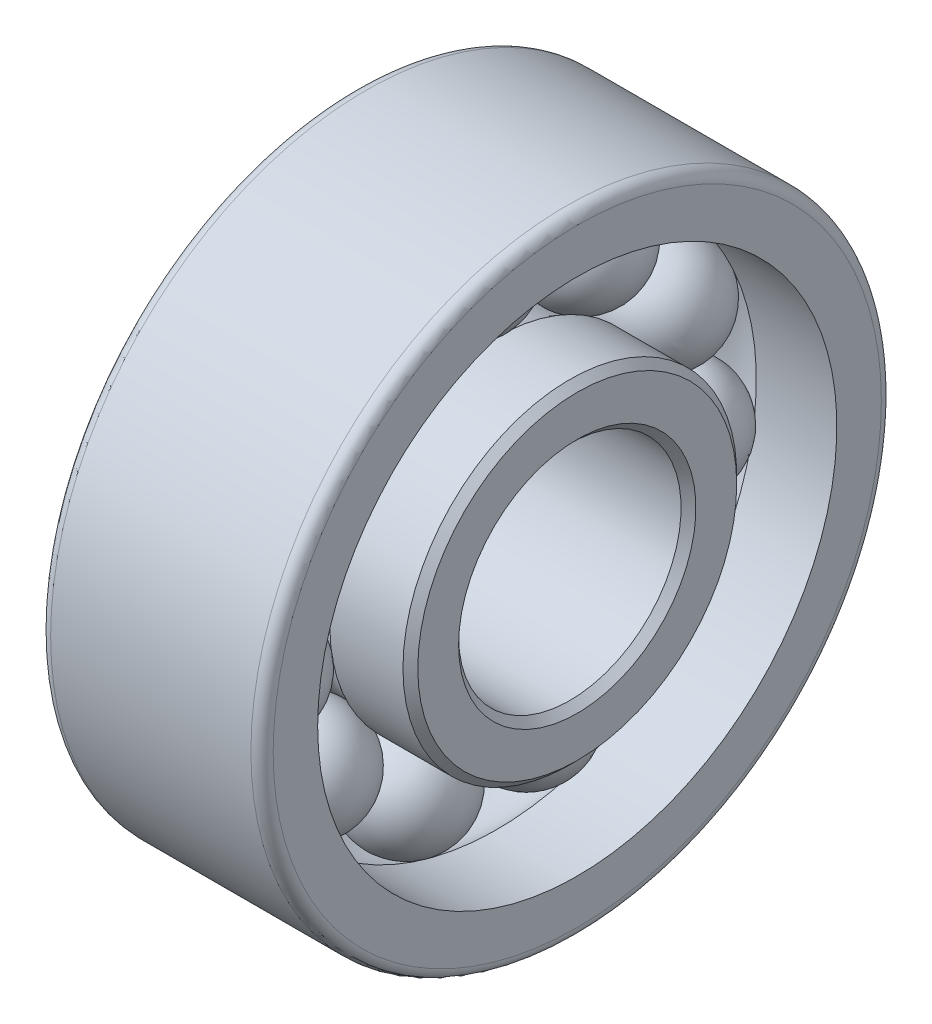
from build123d import *

# Parameters (mm, degrees)
PATTERN_CIRCULAR_5_COUNT = 11
FILLET_1_R               = 0.3
CHAMFER_1_SIZE           = 0.2


with BuildPart() as part:
    # Эскиз1 → Повернуть1 (revolve)
    with BuildSketch(Plane.XY, mode=Mode.PRIVATE) as revolve_1_sk:
        with BuildLine():
            Line((0, 0), (6, 0))
            Line((6, 0), (6, 1.5))
            Line((6, 1.5), (3.829156198, 1.5))
            ThreePointArc((3.829156198, 1.5), (3, 1.25), (2.170843802, 1.5))
            Line((2.170843802, 1.5), (0, 1.5))
            Line((0, 1.5), (0, 0))
        make_face()
        with BuildLine():
            Line((0, 4), (2.170843802, 4))
            ThreePointArc((2.170843802, 4), (3, 4.25), (3.829156198, 4))
            Line((3.829156198, 4), (6, 4))
            Line((6, 4), (6, 5.5))
            Line((6, 5.5), (0, 5.5))
            Line((0, 5.5), (0, 4))
        make_face()
    revolve(revolve_1_sk.sketch.rotate(Axis((-1.066901408, -3, 0), (1, 0, 0)), 90), axis=Axis((-1.066901408, -3, 0), (1, 0, 0)))

    # Скругление1
    fillet_1_edges = [part.edges().sort_by_distance(p)[0] for p in [
        (0, -3, -8.5),
        (6, -3, -8.5),
    ]]
    fillet(fillet_1_edges, radius=FILLET_1_R)

    # Фаска1
    chamfer_1_edges = [part.edges().sort_by_distance(p)[0] for p in [
        (0, -3, -4.5),
        (6, -3, -4.5),
        (6, -3, -3),
        (0, -3, -3),
    ]]
    chamfer(chamfer_1_edges, length=CHAMFER_1_SIZE)


with BuildPart() as body_2:
    # Эскиз2 → Повернуть2 (revolve)
    with BuildSketch(Plane.XY):
        with BuildLine():
            Line((3, 4.25), (3, 1.25))
            ThreePointArc((3, 1.25), (1.5, 2.75), (3, 4.25))
        make_face()
    revolve(axis=Axis((3, 4.25, 0), (0, -1, 0)))


with BuildPart() as pattern_circular_5_1:
    # Круговой массив5: pattern copy
    add(body_2.part.rotate(Axis((0, -3, 0), (1, 0, 0)), 1 * 360 / PATTERN_CIRCULAR_5_COUNT))


with BuildPart() as pattern_circular_5_2:
    # Круговой массив5: pattern copy
    add(body_2.part.rotate(Axis((0, -3, 0), (1, 0, 0)), 2 * 360 / PATTERN_CIRCULAR_5_COUNT))


with BuildPart() as pattern_circular_5_3:
    # Круговой массив5: pattern copy
    add(body_2.part.rotate(Axis((0, -3, 0), (1, 0, 0)), 3 * 360 / PATTERN_CIRCULAR_5_COUNT))


with BuildPart() as pattern_circular_5_4:
    # Круговой массив5: pattern copy
    add(body_2.part.rotate(Axis((0, -3, 0), (1, 0, 0)), 4 * 360 / PATTERN_CIRCULAR_5_COUNT))


with BuildPart() as pattern_circular_5_5:
    # Круговой массив5: pattern copy
    add(body_2.part.rotate(Axis((0, -3, 0), (1, 0, 0)), 5 * 360 / PATTERN_CIRCULAR_5_COUNT))


with BuildPart() as pattern_circular_5_6:
    # Круговой массив5: pattern copy
    add(body_2.part.rotate(Axis((0, -3, 0), (1, 0, 0)), 6 * 360 / PATTERN_CIRCULAR_5_COUNT))


with BuildPart() as pattern_circular_5_7:
    # Круговой массив5: pattern copy
    add(body_2.part.rotate(Axis((0, -3, 0), (1, 0, 0)), 7 * 360 / PATTERN_CIRCULAR_5_COUNT))


with BuildPart() as pattern_circular_5_8:
    # Круговой массив5: pattern copy
    add(body_2.part.rotate(Axis((0, -3, 0), (1, 0, 0)), 8 * 360 / PATTERN_CIRCULAR_5_COUNT))


with BuildPart() as pattern_circular_5_9:
    # Круговой массив5: pattern copy
    add(body_2.part.rotate(Axis((0, -3, 0), (1, 0, 0)), 9 * 360 / PATTERN_CIRCULAR_5_COUNT))


with BuildPart() as pattern_circular_5_10:
    # Круговой массив5: pattern copy
    add(body_2.part.rotate(Axis((0, -3, 0), (1, 0, 0)), 10 * 360 / PATTERN_CIRCULAR_5_COUNT))


solid = Compound([part.part, body_2.part, pattern_circular_5_1.part, pattern_circular_5_2.part, pattern_circular_5_3.part, pattern_circular_5_4.part, pattern_circular_5_5.part, pattern_circular_5_6.part, pattern_circular_5_7.part, pattern_circular_5_8.part, pattern_circular_5_9.part, pattern_circular_5_10.part])
